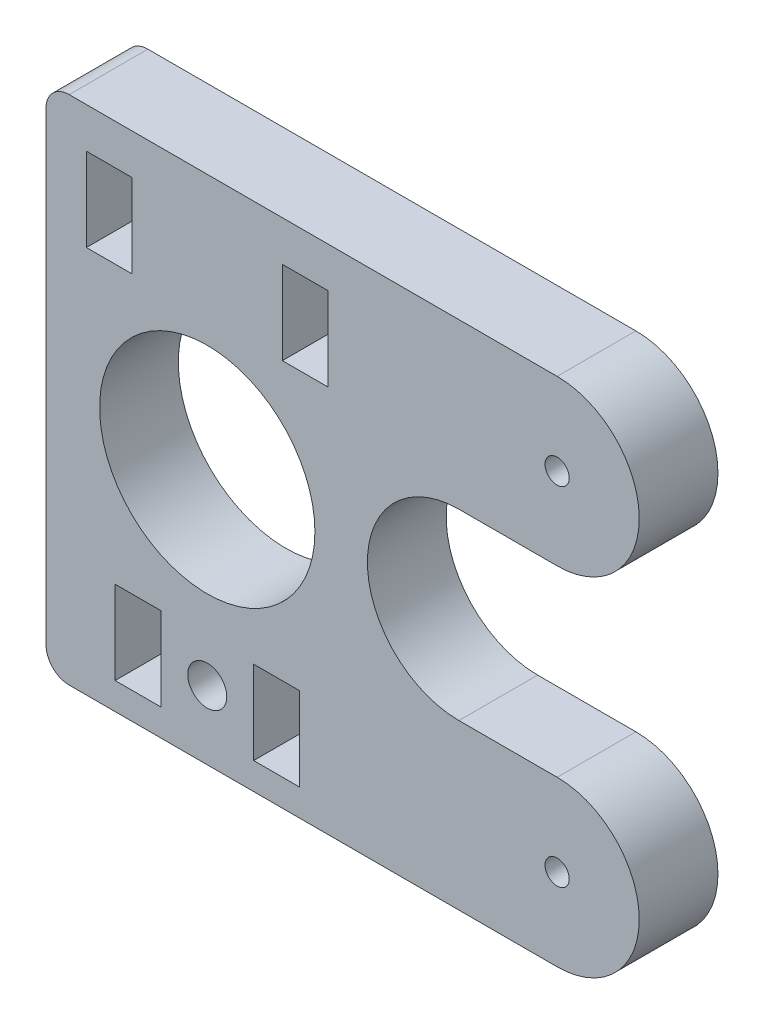
from build123d import *

# Parameters (mm, degrees)
SKETCH1_R           = 0.9
SKETCH1_R_2         = 1.45
SKETCH1_R_3         = 8
SKETCH1_W           = 3.400011
SKETCH1_H           = 6.2
SKETCH1_W_2         = 3.4
BOSS_EXTRUDE2_DEPTH = 5.85


with BuildPart() as part:
    # Sketch1 → Boss-Extrude2 (new body)
    with BuildSketch(Plane.XY):
        with BuildLine():
            Line((669.21684417, 349.76545661), (648.4638119, 349.76545661))
            ThreePointArc((648.4638119, 349.76545661), (647.249496344, 349.262470637), (646.746510371, 348.048155081))
            Line((646.746510371, 348.048155081), (646.746510371, 313.482758138))
            ThreePointArc((646.746510371, 313.482758138), (647.249496344, 312.268442582), (648.4638119, 311.76545661))
            Line((648.4638119, 311.76545661), (669.21684417, 311.76545661))
            Line((669.21684417, 311.76545661), (684.726521371, 311.76545661))
            ThreePointArc((684.726521371, 311.76545661), (690.826521371, 317.86545661), (684.726521371, 323.96545661))
            Line((684.726521371, 323.96545661), (677.426521371, 323.96545661))
            ThreePointArc((677.426521371, 323.96545661), (670.626521371, 330.76545661), (677.426521371, 337.56545661))
            Line((677.426521371, 337.56545661), (684.726521371, 337.56545661))
            ThreePointArc((684.726521371, 337.56545661), (690.826521371, 343.66545661), (684.726521371, 349.76545661))
            Line((684.726521371, 349.76545661), (669.21684417, 349.76545661))
        make_face()
        with Locations((684.726521371, 343.66545661)):
            Circle(SKETCH1_R, mode=Mode.SUBTRACT)
        with Locations((684.726521371, 317.86545661)):
            Circle(SKETCH1_R, mode=Mode.SUBTRACT)
        with Locations((658.726521371, 316.86545661)):
            Circle(SKETCH1_R_2, mode=Mode.SUBTRACT)
        with Locations((658.726521371, 330.76545661)):
            Circle(SKETCH1_R_3, mode=Mode.SUBTRACT)
        with Locations((651.446515871, 343.66545661)):
            Rectangle(SKETCH1_W, SKETCH1_H, mode=Mode.SUBTRACT)
        with Locations((653.576521371, 316.86545661)):
            Rectangle(SKETCH1_W_2, SKETCH1_H, mode=Mode.SUBTRACT)
        with Locations((666.006526871, 343.66545661)):
            Rectangle(SKETCH1_W, SKETCH1_H, mode=Mode.SUBTRACT)
        with Locations((663.876521371, 316.86545661)):
            Rectangle(SKETCH1_W_2, SKETCH1_H, mode=Mode.SUBTRACT)
    extrude(amount=BOSS_EXTRUDE2_DEPTH)


solid = part.part
